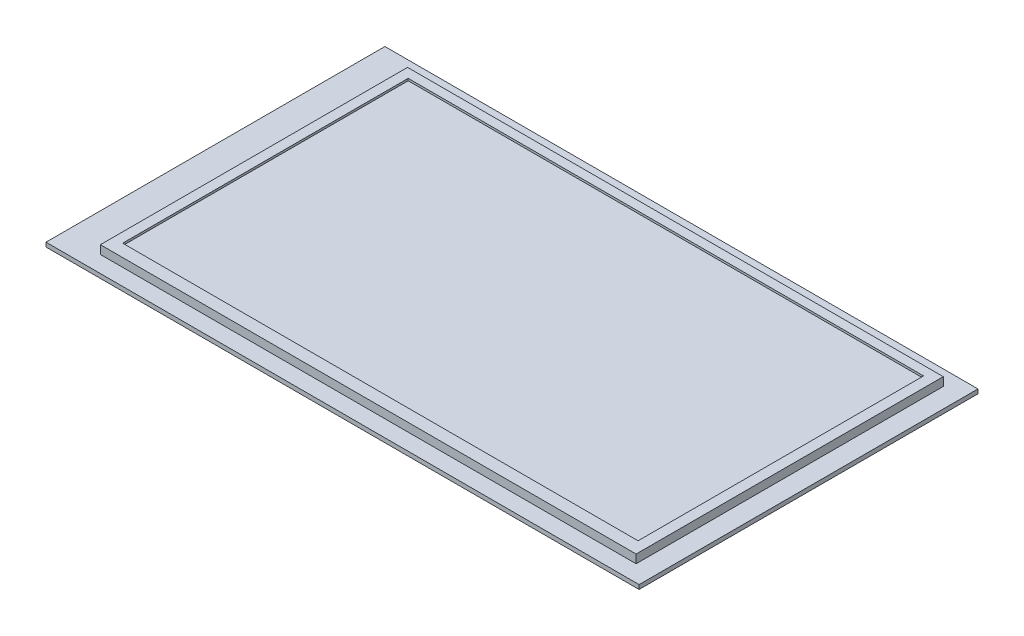
from build123d import *

# Parameters (mm, degrees)
SKETCH_1_W          = 140
SKETCH_1_H          = 80
EXTRUDE_1_DEPTH     = 1
SKETCH_2_W          = 126.458639074
SKETCH_2_H          = 72.505014335
EXTRUDE_2_DEPTH     = 2
SKETCH_3_W          = 121.666196763
SKETCH_3_H          = 67.403382197
CUT_EXTRUDE_1_DEPTH = 0.5


with BuildPart() as part:
    # 草图1 → 凸台-拉伸1 (new body)
    with BuildSketch(Plane(origin=(0, 0, 0), x_dir=(1, 0, 0), z_dir=(0, 1, 0))):
        with Locations((70, -40)):
            Rectangle(SKETCH_1_W, SKETCH_1_H)
    extrude(amount=EXTRUDE_1_DEPTH)

    # 草图2 → 凸台-拉伸2 (add)
    with BuildSketch(Plane(origin=(0, 1, 0), x_dir=(1, 0, 0), z_dir=(0, 1, 0))):
        with Locations((72.164328786, -39.845405087)):
            Rectangle(SKETCH_2_W, SKETCH_2_H)
    extrude(amount=EXTRUDE_2_DEPTH)

    # 草图3 → 切除-拉伸1 (cut)
    with BuildSketch(Plane(origin=(0, 3, 0), x_dir=(1, 0, 0), z_dir=(0, 1, 0))):
        with Locations((72.08703133, -39.458917804)):
            Rectangle(SKETCH_3_W, SKETCH_3_H)
    extrude(amount=-CUT_EXTRUDE_1_DEPTH, mode=Mode.SUBTRACT)


solid = part.part
